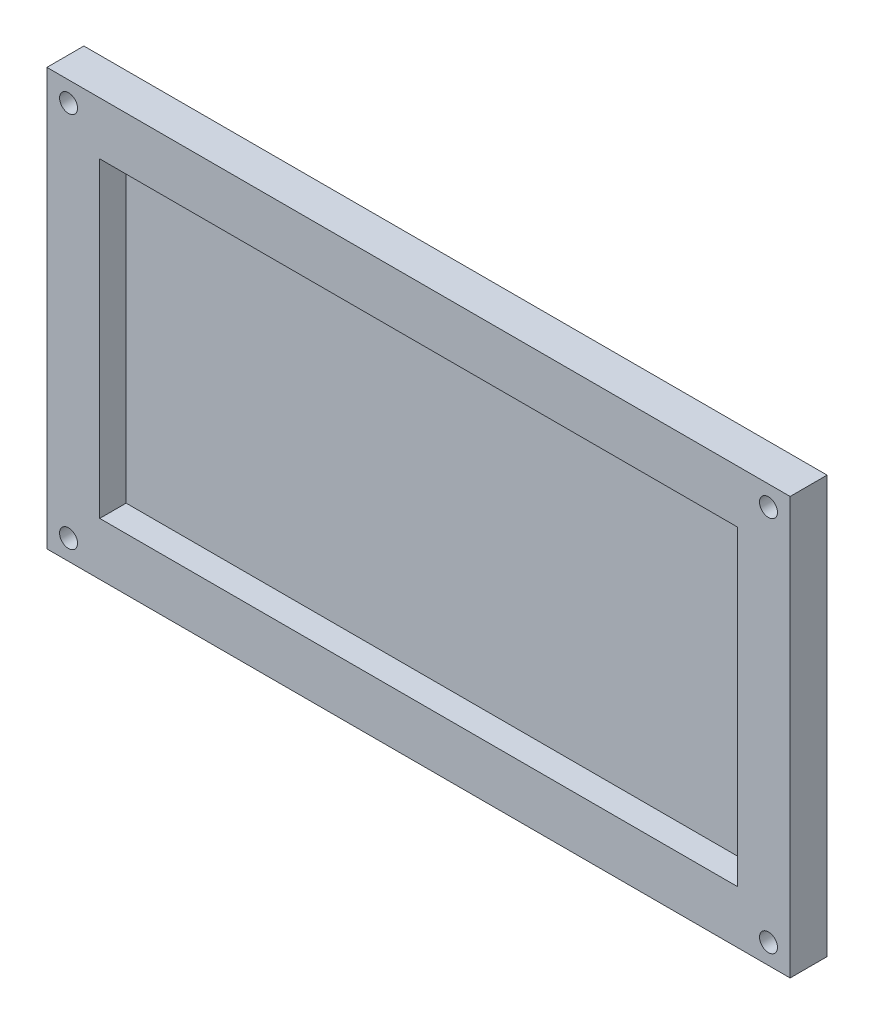
from build123d import *

# Parameters (mm, degrees)
SKETCH_1_W          = 140.7
SKETCH_1_H          = 78.95
SKETCH_1_R          = 1.7
EXTRUDE_1_DEPTH     = 7
SKETCH_2_W          = 120.7
SKETCH_2_H          = 58.95
CUT_EXTRUDE_1_DEPTH = 5


with BuildPart() as part:
    # 草图1 → 凸台-拉伸1 (new body)
    with BuildSketch(Plane.XY):
        Rectangle(SKETCH_1_W, SKETCH_1_H)
        with Locations((-66.25272379, 35.66826865)):
            Circle(SKETCH_1_R, mode=Mode.SUBTRACT)
        with Locations(Location((66.25272379, 35.66826865, 0), (0, 0, 180))):
            Circle(SKETCH_1_R, mode=Mode.SUBTRACT)
        with Locations((66.25272379, -35.66826865)):
            Circle(SKETCH_1_R, mode=Mode.SUBTRACT)
        with Locations(Location((-66.25272379, -35.66826865, 0), (0, 0, 180))):
            Circle(SKETCH_1_R, mode=Mode.SUBTRACT)
    extrude(amount=EXTRUDE_1_DEPTH)

    # 草图2 → 切除-拉伸1 (cut)
    with BuildSketch(Plane.XY.offset(7)):
        Rectangle(SKETCH_2_W, SKETCH_2_H)
    extrude(amount=-CUT_EXTRUDE_1_DEPTH, mode=Mode.SUBTRACT)


solid = part.part
